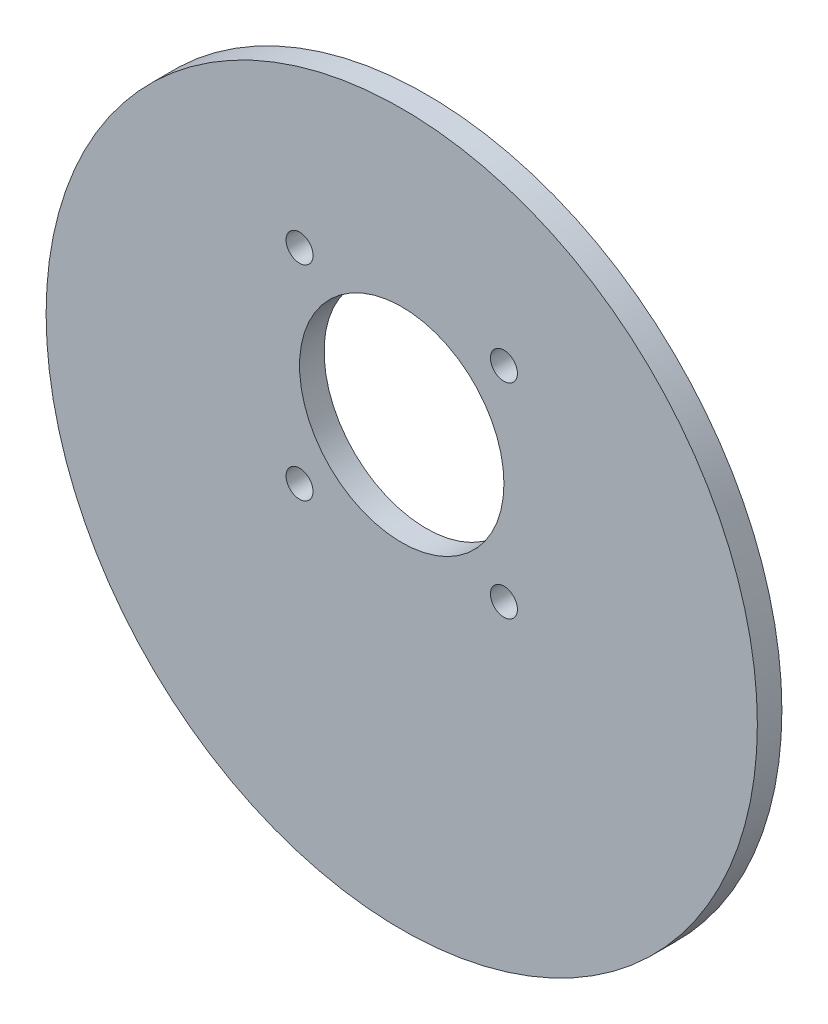
from build123d import *

# Parameters (mm, degrees)
SKETCH1_R           = 43.5
SKETCH1_R_2         = 1.65
SKETCH1_R_3         = 12.5
BOSS_EXTRUDE1_DEPTH = 3


with BuildPart() as part:
    # Sketch1 → Boss-Extrude1 (new body)
    with BuildSketch(Plane.XY):
        Circle(SKETCH1_R)
        with Locations((-12.5, -2.5)):
            Circle(SKETCH1_R_2, mode=Mode.SUBTRACT)
        with Locations((12.5, -2.5)):
            Circle(SKETCH1_R_2, mode=Mode.SUBTRACT)
        with Locations((12.5, 22.5)):
            Circle(SKETCH1_R_2, mode=Mode.SUBTRACT)
        with Locations((-12.5, 22.5)):
            Circle(SKETCH1_R_2, mode=Mode.SUBTRACT)
        with Locations((0, 10)):
            Circle(SKETCH1_R_3, mode=Mode.SUBTRACT)
    extrude(amount=BOSS_EXTRUDE1_DEPTH)


solid = part.part
